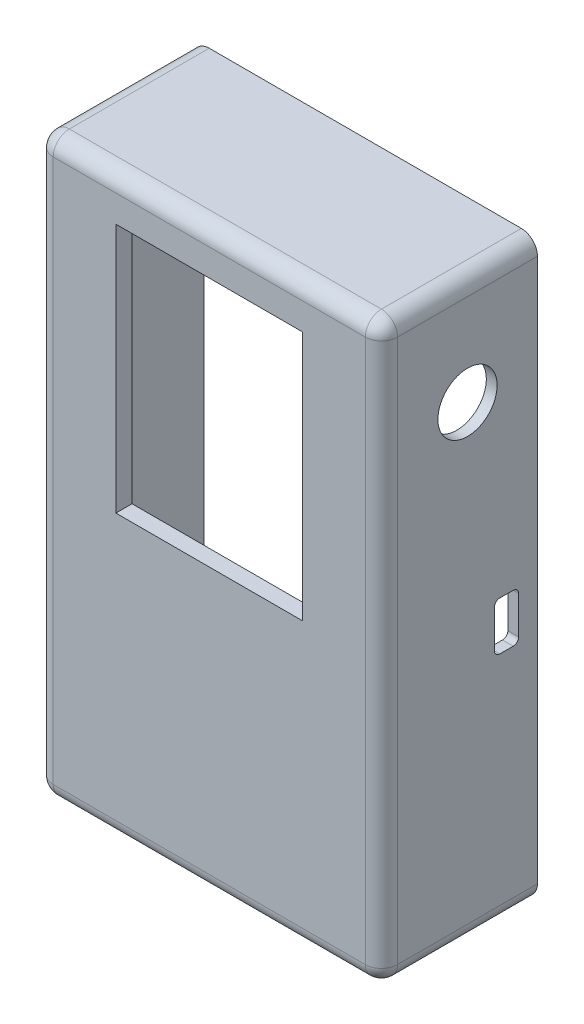
from build123d import *

# Parameters (mm, degrees)
ESQUISSE1_W             = 60
ESQUISSE1_H             = 103
BOSS_EXTRU_1_DEPTH      = 3
ESQUISSE2_W             = 34.7
ESQUISSE2_H             = 46.5
ENL_V_MAT_EXTRU_1_DEPTH = 120.239255281
ESQUISSE3_W             = 41
ESQUISSE3_H             = 2.8
ENL_V_MAT_EXTRU_2_DEPTH = 1.8
BOSS_EXTRU_2_DEPTH      = 26
BOSS_EXTRU_2_DEPTH_BACK = 3
ESQUISSE4_W             = 64
ESQUISSE4_H             = 107
ESQUISSE4_W_2           = 60
ESQUISSE4_H_2           = 103
ENL_V_MAT_EXTRU_3_REACH = 127.686
ESQUISSE5_R             = 5.5
ESQUISSE5_W             = 4.5
ESQUISSE5_H             = 9
CONG_1_R                = 1
CONG_2_R                = 3
ESQUISSE6_W             = 5
ESQUISSE6_H             = 5
BOSS_EXTRU_3_DEPTH      = 26
CONG_3_R                = 4
ESQUISSE7_R             = 1.3
ENL_V_MAT_EXTRU_4_DEPTH = 10
ENL_V_MAT_EXTRU_5_REACH = 128.369
ESQUISSE8_R             = 7


with BuildPart() as part:
    # Esquisse1 → Boss.-Extru.1 (new body)
    with BuildSketch(Plane.XY):
        with Locations((30, 51.5)):
            Rectangle(ESQUISSE1_W, ESQUISSE1_H)
    extrude(amount=BOSS_EXTRU_1_DEPTH)

    # Esquisse2 → Enlèv. mat.-Extru.1 (cut, through all)
    with BuildSketch(Plane.XY.offset(3)):
        with Locations((30, 73.75)):
            Rectangle(ESQUISSE2_W, ESQUISSE2_H)
    extrude(amount=-ENL_V_MAT_EXTRU_1_DEPTH, mode=Mode.SUBTRACT)

    # Esquisse3 → Enlèv. mat.-Extru.2 (cut)
    with BuildSketch(Plane(origin=(0, 0, 0), x_dir=(-1, 0, 0), z_dir=(0, 0, -1))):
        with Locations((-30, 99.6)):
            Rectangle(ESQUISSE3_W, ESQUISSE3_H)
    extrude(amount=-ENL_V_MAT_EXTRU_2_DEPTH, mode=Mode.SUBTRACT)

    # Esquisse4 → Boss.-Extru.2 (add, two sides: drawn at the far end of the back side and taken through both)
    with BuildSketch(Plane(origin=(0, 0, 0), x_dir=(-1, 0, 0), z_dir=(0, 0, -1)).offset(-BOSS_EXTRU_2_DEPTH_BACK)):
        with Locations((-30, 51.5)):
            Rectangle(ESQUISSE4_W, ESQUISSE4_H)
        with Locations((-30, 51.5)):
            Rectangle(ESQUISSE4_W_2, ESQUISSE4_H_2, mode=Mode.SUBTRACT)
    extrude(amount=BOSS_EXTRU_2_DEPTH + BOSS_EXTRU_2_DEPTH_BACK)

    # Esquisse5 → Enlèv. mat.-Extru.3 (cut, up to next)
    with BuildSketch(Plane(origin=(62, 0, 0), x_dir=(0, 0, -1), z_dir=(1, 0, 0)), mode=Mode.PRIVATE) as enl_v_mat_extru_3_sk1:
        with Locations(Location((13, 85, 0), (0, 0, 90))):
            Circle(ESQUISSE5_R)
    enl_v_mat_extru_3_tool1 = extrude(enl_v_mat_extru_3_sk1.sketch, amount=-ENL_V_MAT_EXTRU_3_REACH, mode=Mode.PRIVATE) & part.part
    # Esquisse5 → Enlèv. mat.-Extru.3 (cut, up to next)
    with BuildSketch(Plane(origin=(62, 0, 0), x_dir=(0, 0, -1), z_dir=(1, 0, 0)), mode=Mode.PRIVATE) as enl_v_mat_extru_3_sk2:
        with Locations((20.25, 46)):
            Rectangle(ESQUISSE5_W, ESQUISSE5_H)
    enl_v_mat_extru_3_tool2 = extrude(enl_v_mat_extru_3_sk2.sketch, amount=-ENL_V_MAT_EXTRU_3_REACH, mode=Mode.PRIVATE) & part.part
    add(enl_v_mat_extru_3_tool1.solids().sort_by_distance((62, 85, -13))[0], mode=Mode.SUBTRACT)
    add(enl_v_mat_extru_3_tool2.solids().sort_by_distance((62, 46, -20.25))[0], mode=Mode.SUBTRACT)

    # Congé1
    cong_1_edges = [part.edges().sort_by_distance(p)[0] for p in [
        (61, 41.5, -18),
        (61, 50.5, -18),
        (61, 50.5, -22.5),
        (61, 41.5, -22.5),
    ]]
    fillet(cong_1_edges, radius=CONG_1_R)

    # Congé2
    cong_2_edges = [part.edges().sort_by_distance(p)[0] for p in [
        (-2, 105, -11.5),
        (-2, 51.5, 3),
        (-2, -2, -11.5),
        (30, -2, 3),
        (62, -2, -11.5),
        (62, 51.5, 3),
        (62, 105, -11.5),
        (30, 105, 3),
    ]]
    fillet(cong_2_edges, radius=CONG_2_R)

    # Esquisse6 → Boss.-Extru.3 (add)
    with BuildSketch(Plane(origin=(0, 0, -26), x_dir=(-1, 0, 0), z_dir=(0, 0, -1))):
        with Locations((-57.5, 100.5)):
            Rectangle(ESQUISSE6_W, ESQUISSE6_H)
        with Locations((-2.5, 100.5)):
            Rectangle(ESQUISSE6_W, ESQUISSE6_H)
        with Locations((-2.5, 2.5)):
            Rectangle(ESQUISSE6_W, ESQUISSE6_H)
        with Locations((-57.5, 2.5)):
            Rectangle(ESQUISSE6_W, ESQUISSE6_H)
    extrude(amount=-BOSS_EXTRU_3_DEPTH)

    # Congé3
    cong_3_edges = [part.edges().sort_by_distance(p)[0] for p in [
        (55, 98, -13),
        (5, 98, -13),
        (5, 5, -13),
        (55, 5, -13),
    ]]
    fillet(cong_3_edges, radius=CONG_3_R)

    # Esquisse7 → Enlèv. mat.-Extru.4 (cut)
    with BuildSketch(Plane(origin=(0, 0, -26), x_dir=(-1, 0, 0), z_dir=(0, 0, -1))):
        with Locations((-1.353553391, 101.646446609)):
            Circle(ESQUISSE7_R)
        with Locations(Location((-58.646446609, 101.646446609, 0), (0, 0, 180))):
            Circle(ESQUISSE7_R)
        with Locations((-58.646446609, 1.353553391)):
            Circle(ESQUISSE7_R)
        with Locations(Location((-1.353553391, 1.353553391, 0), (0, 0, 180))):
            Circle(ESQUISSE7_R)
    extrude(amount=-ENL_V_MAT_EXTRU_4_DEPTH, mode=Mode.SUBTRACT)

    # Esquisse8 → Enlèv. mat.-Extru.5 (cut, up to next)
    with BuildSketch(Plane(origin=(0, -2, 0), x_dir=(-1, 0, 0), z_dir=(0, -1, 0)), mode=Mode.PRIVATE) as enl_v_mat_extru_5_sk1:
        with Locations(Location((-14, 11.5, 0), (0, 0, 180))):
            Circle(ESQUISSE8_R)
    enl_v_mat_extru_5_tool1 = extrude(enl_v_mat_extru_5_sk1.sketch, amount=-ENL_V_MAT_EXTRU_5_REACH, mode=Mode.PRIVATE) & part.part
    add(enl_v_mat_extru_5_tool1.solids().sort_by_distance((14, -2, -11.5))[0], mode=Mode.SUBTRACT)


solid = part.part
